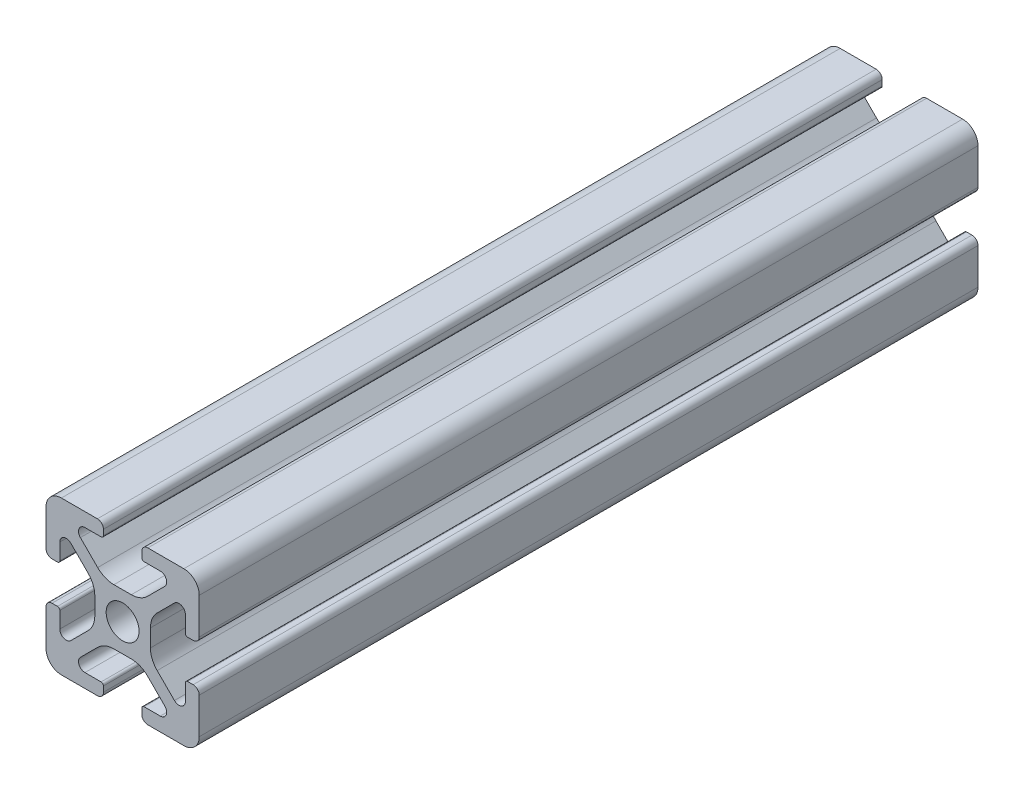
from build123d import *

# Parameters (mm, degrees)
SKETCH1_R           = 2.1463
BOSS_EXTRUDE1_DEPTH = 50.8


with BuildPart() as part:
    # Sketch1 → Boss-Extrude1 (new, symmetric)
    with BuildSketch(Plane.XY):
        with BuildLine():
            Line((-9.9949, 7.9883), (-9.9949, 3.2893))
            ThreePointArc((-9.9949, 3.2893), (-9.76427588, 2.73252412), (-9.2075, 2.5019))
            Line((-9.2075, 2.5019), (-8.4963, 2.5019))
            ThreePointArc((-8.4963, 2.5019), (-8.280773853, 2.591173853), (-8.1915, 2.8067))
            Line((-8.1915, 2.8067), (-8.1915, 4.9149))
            ThreePointArc((-8.1915, 4.9149), (-7.674065253, 5.689295824), (-6.760603096, 5.507596904))
            Line((-6.760603096, 5.507596904), (-4.505765747, 3.252759555))
            ThreePointArc((-4.505765747, 3.252759555), (-3.856054457, 2.280397894), (-3.627906192, 1.133419111))
            Line((-3.627906192, 1.133419111), (-3.627906192, -1.133419111))
            ThreePointArc((-3.627906192, -1.133419111), (-3.856054457, -2.280397894), (-4.505765747, -3.252759555))
            Line((-4.505765747, -3.252759555), (-6.760603096, -5.507596904))
            ThreePointArc((-6.760603096, -5.507596904), (-7.674065253, -5.689295824), (-8.1915, -4.9149))
            Line((-8.1915, -4.9149), (-8.1915, -2.8067))
            ThreePointArc((-8.1915, -2.8067), (-8.280773853, -2.591173853), (-8.4963, -2.5019))
            Line((-8.4963, -2.5019), (-9.2075, -2.5019))
            ThreePointArc((-9.2075, -2.5019), (-9.76427588, -2.73252412), (-9.9949, -3.2893))
            Line((-9.9949, -3.2893), (-9.9949, -7.9883))
            ThreePointArc((-9.9949, -7.9883), (-9.407180467, -9.407180467), (-7.9883, -9.9949))
            Line((-7.9883, -9.9949), (-3.2893, -9.9949))
            ThreePointArc((-3.2893, -9.9949), (-2.73252412, -9.76427588), (-2.5019, -9.2075))
            Line((-2.5019, -9.2075), (-2.5019, -8.4963))
            ThreePointArc((-2.5019, -8.4963), (-2.591173853, -8.280773853), (-2.8067, -8.1915))
            Line((-2.8067, -8.1915), (-4.9149, -8.1915))
            ThreePointArc((-4.9149, -8.1915), (-5.689295824, -7.674065253), (-5.507596904, -6.760603096))
            Line((-5.507596904, -6.760603096), (-3.252759555, -4.505765747))
            ThreePointArc((-3.252759555, -4.505765747), (-2.280397894, -3.856054457), (-1.133419111, -3.627906192))
            Line((-1.133419111, -3.627906192), (1.133419111, -3.627906192))
            ThreePointArc((1.133419111, -3.627906192), (2.280397894, -3.856054457), (3.252759555, -4.505765747))
            Line((3.252759555, -4.505765747), (5.507596904, -6.760603096))
            ThreePointArc((5.507596904, -6.760603096), (5.689295824, -7.674065253), (4.9149, -8.1915))
            Line((4.9149, -8.1915), (2.8067, -8.1915))
            ThreePointArc((2.8067, -8.1915), (2.591173853, -8.280773853), (2.5019, -8.4963))
            Line((2.5019, -8.4963), (2.5019, -9.2075))
            ThreePointArc((2.5019, -9.2075), (2.73252412, -9.76427588), (3.2893, -9.9949))
            Line((3.2893, -9.9949), (7.9883, -9.9949))
            ThreePointArc((7.9883, -9.9949), (9.407180467, -9.407180467), (9.9949, -7.9883))
            Line((9.9949, -7.9883), (9.9949, -3.2893))
            ThreePointArc((9.9949, -3.2893), (9.76427588, -2.73252412), (9.2075, -2.5019))
            Line((9.2075, -2.5019), (8.4963, -2.5019))
            ThreePointArc((8.4963, -2.5019), (8.280773853, -2.591173853), (8.1915, -2.8067))
            Line((8.1915, -2.8067), (8.1915, -4.9149))
            ThreePointArc((8.1915, -4.9149), (7.674065253, -5.689295824), (6.760603096, -5.507596904))
            Line((6.760603096, -5.507596904), (4.505765747, -3.252759555))
            ThreePointArc((4.505765747, -3.252759555), (3.856054457, -2.280397894), (3.627906192, -1.133419111))
            Line((3.627906192, -1.133419111), (3.627906192, 1.133419111))
            ThreePointArc((3.627906192, 1.133419111), (3.856054457, 2.280397894), (4.505765747, 3.252759555))
            Line((4.505765747, 3.252759555), (6.760603096, 5.507596904))
            ThreePointArc((6.760603096, 5.507596904), (7.674065253, 5.689295824), (8.1915, 4.9149))
            Line((8.1915, 4.9149), (8.1915, 2.8067))
            ThreePointArc((8.1915, 2.8067), (8.280773853, 2.591173853), (8.4963, 2.5019))
            Line((8.4963, 2.5019), (9.2075, 2.5019))
            ThreePointArc((9.2075, 2.5019), (9.76427588, 2.73252412), (9.9949, 3.2893))
            Line((9.9949, 3.2893), (9.9949, 7.9883))
            ThreePointArc((9.9949, 7.9883), (9.407180467, 9.407180467), (7.9883, 9.9949))
            Line((7.9883, 9.9949), (3.2893, 9.9949))
            ThreePointArc((3.2893, 9.9949), (2.73252412, 9.76427588), (2.5019, 9.2075))
            Line((2.5019, 9.2075), (2.5019, 8.4963))
            ThreePointArc((2.5019, 8.4963), (2.591173853, 8.280773853), (2.8067, 8.1915))
            Line((2.8067, 8.1915), (4.9149, 8.1915))
            ThreePointArc((4.9149, 8.1915), (5.689295824, 7.674065253), (5.507596904, 6.760603096))
            Line((5.507596904, 6.760603096), (3.252759555, 4.505765747))
            ThreePointArc((3.252759555, 4.505765747), (2.280397894, 3.856054457), (1.133419111, 3.627906192))
            Line((1.133419111, 3.627906192), (-1.133419111, 3.627906192))
            ThreePointArc((-1.133419111, 3.627906192), (-2.280397894, 3.856054457), (-3.252759555, 4.505765747))
            Line((-3.252759555, 4.505765747), (-5.507596904, 6.760603096))
            ThreePointArc((-5.507596904, 6.760603096), (-5.689295824, 7.674065253), (-4.9149, 8.1915))
            Line((-4.9149, 8.1915), (-2.8067, 8.1915))
            ThreePointArc((-2.8067, 8.1915), (-2.591173853, 8.280773853), (-2.5019, 8.4963))
            Line((-2.5019, 8.4963), (-2.5019, 9.2075))
            ThreePointArc((-2.5019, 9.2075), (-2.73252412, 9.76427588), (-3.2893, 9.9949))
            Line((-3.2893, 9.9949), (-7.9883, 9.9949))
            ThreePointArc((-7.9883, 9.9949), (-9.407180467, 9.407180467), (-9.9949, 7.9883))
        make_face()
        Circle(SKETCH1_R, mode=Mode.SUBTRACT)
    extrude(amount=BOSS_EXTRUDE1_DEPTH, both=True)


solid = part.part
